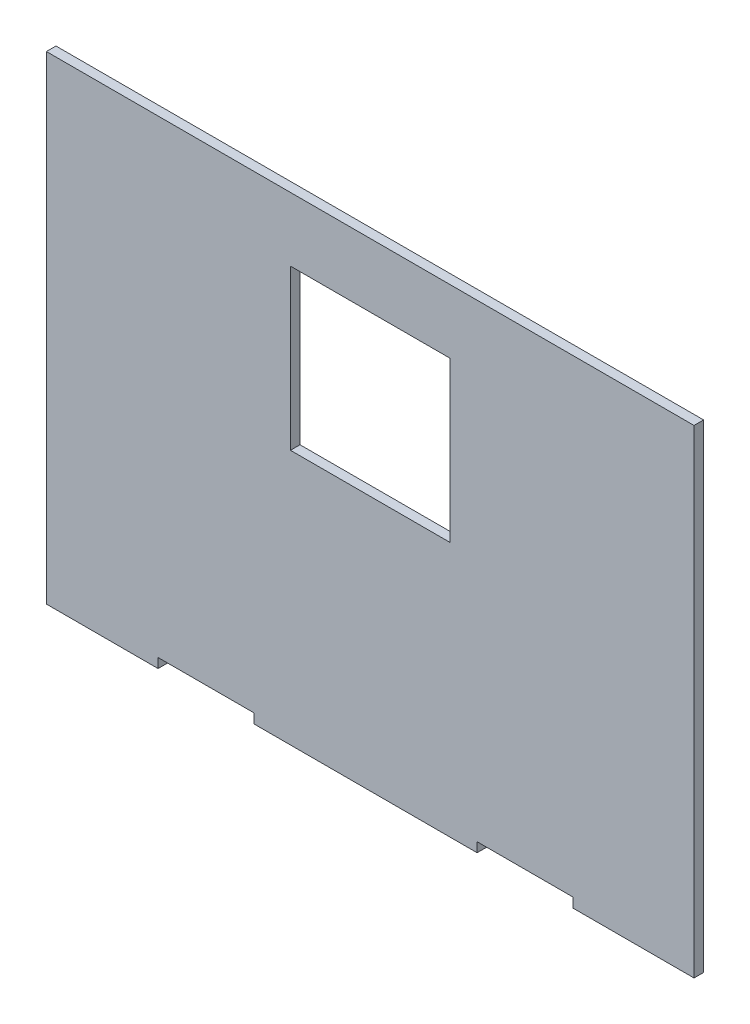
from build123d import *

# Parameters (mm, degrees)
SKETCH1_W           = 203
SKETCH1_H           = 150
BOSS_EXTRUDE1_DEPTH = 3
SKETCH2_W           = 50
SKETCH2_H           = 50
CUT_EXTRUDE1_DEPTH  = 10
SKETCH3_W           = 30
SKETCH3_H           = 3
CUT_EXTRUDE2_DEPTH  = 10


with BuildPart() as part:
    # Sketch1 → Boss-Extrude1 (new body)
    with BuildSketch(Plane.XY):
        Rectangle(SKETCH1_W, SKETCH1_H)
    extrude(amount=BOSS_EXTRUDE1_DEPTH)

    # Sketch2 → Cut-Extrude1 (cut)
    with BuildSketch(Plane.XY.offset(3)):
        with Locations((0, 30)):
            Rectangle(SKETCH2_W, SKETCH2_H)
    extrude(amount=-CUT_EXTRUDE1_DEPTH, mode=Mode.SUBTRACT)

    # Sketch3 → Cut-Extrude2 (cut)
    with BuildSketch(Plane.XY.offset(3)):
        with Locations((-51.5, -73.5)):
            Rectangle(SKETCH3_W, SKETCH3_H)
        with Locations((48.5, -73.5)):
            Rectangle(SKETCH3_W, SKETCH3_H)
    extrude(amount=-CUT_EXTRUDE2_DEPTH, mode=Mode.SUBTRACT)


solid = part.part
